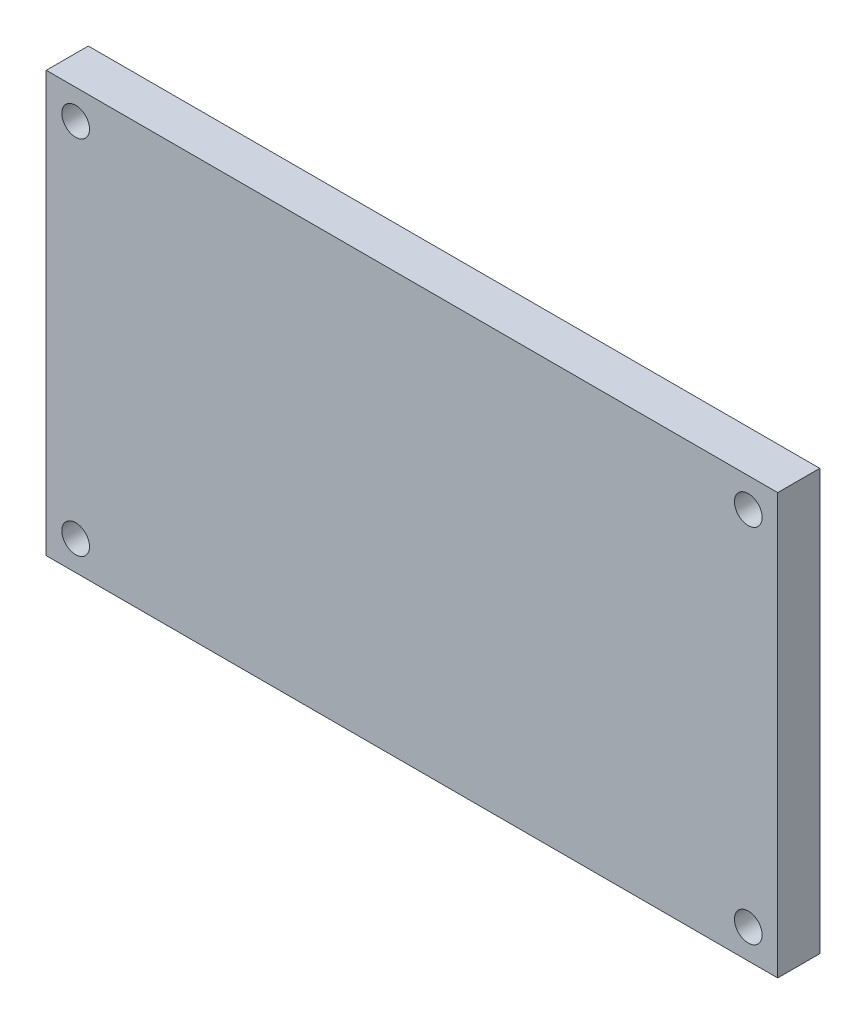
from build123d import *

# Parameters (mm, degrees)
SKETCH_1_W      = 87
SKETCH_1_H      = 50
SKETCH_1_R      = 1.65
EXTRUDE_1_DEPTH = 5


with BuildPart() as part:
    # 草图1 → 凸台-拉伸1 (new body)
    with BuildSketch(Plane.XY):
        Rectangle(SKETCH_1_W, SKETCH_1_H)
        with Locations((40, 21.5)):
            Circle(SKETCH_1_R, mode=Mode.SUBTRACT)
        with Locations((40, -21.5)):
            Circle(SKETCH_1_R, mode=Mode.SUBTRACT)
        with Locations((-40, 21.5)):
            Circle(SKETCH_1_R, mode=Mode.SUBTRACT)
        with Locations((-40, -21.5)):
            Circle(SKETCH_1_R, mode=Mode.SUBTRACT)
    extrude(amount=EXTRUDE_1_DEPTH)


solid = part.part
